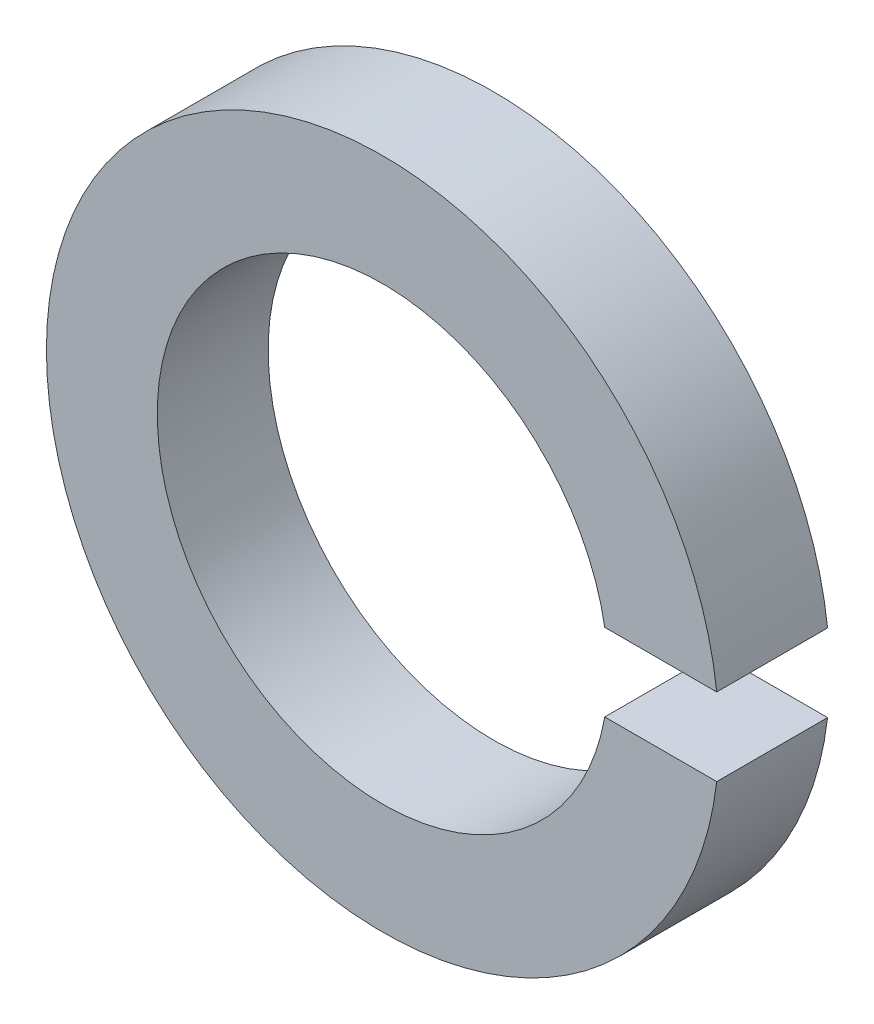
from build123d import *

# Parameters (mm, degrees)
SKETCH_1_R          = 9.1
SKETCH_1_R_2        = 6.1
EXTRUDE_1_DEPTH     = 3
SKETCH_2_W          = 3.469576293
SKETCH_2_H          = 2.1
CUT_EXTRUDE_1_DEPTH = 14.2143861


with BuildPart() as part:
    # Эскиз1 → Вытянуть1 (new body)
    with BuildSketch(Plane.XY):
        Circle(SKETCH_1_R)
        Circle(SKETCH_1_R_2, mode=Mode.SUBTRACT)
    extrude(amount=EXTRUDE_1_DEPTH)

    # Эскиз2 → Вырез-Вытянуть1 (cut, through all)
    with BuildSketch(Plane.XY.offset(3)):
        with Locations((7.545498589, 0)):
            Rectangle(SKETCH_2_W, SKETCH_2_H)
    extrude(amount=-CUT_EXTRUDE_1_DEPTH, mode=Mode.SUBTRACT)


solid = part.part
